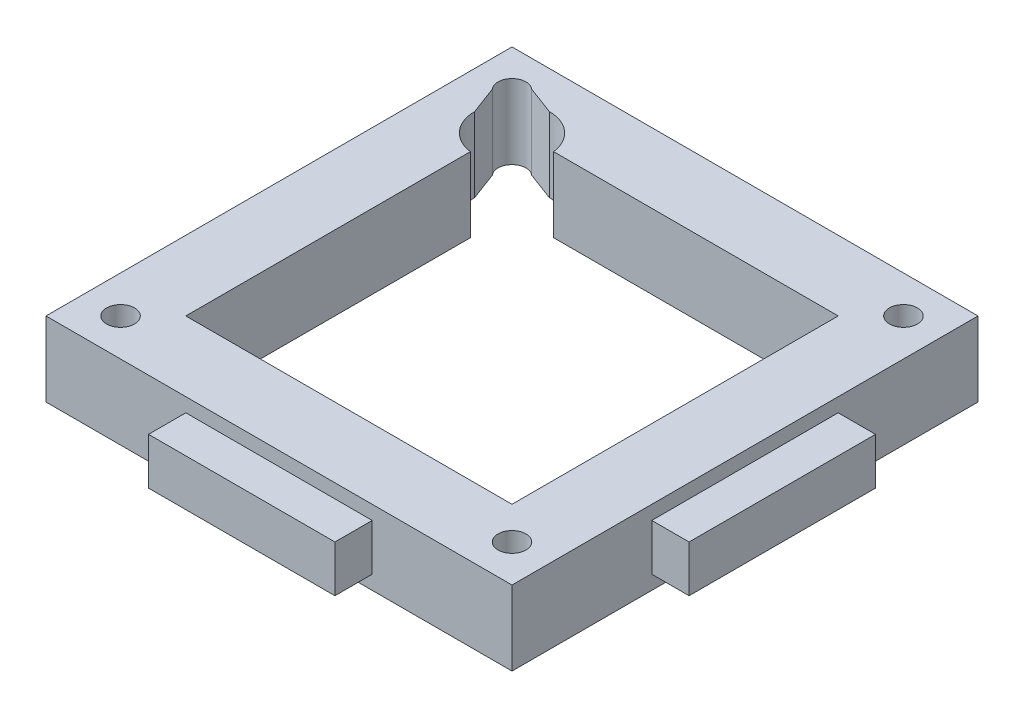
from build123d import *

# Parameters (mm, degrees)
SKETCH1_W         = 50
SKETCH1_H         = 50
SKETCH1_R         = 1.5
SUPPORT_DEPTH     = 8
NORTH_START       = -25
SKETCH2_W         = 20
SKETCH2_H         = 5
NORTH_CUT_DEPTH   = 4
SOUTH_START       = 25
SKETCH2_2_W       = 20
SKETCH2_2_H       = 5
SOUTH_DOWEL_DEPTH = 4
EAST_START        = 25
SKETCH3_W         = 20
SKETCH3_H         = 5
EAST_DOWEL_DEPTH  = 4
WEST_START        = -25
SKETCH3_3_W       = 20
SKETCH3_3_H       = 5
WEST_CUT_DEPTH    = 4


with BuildPart() as part:
    # Sketch1 → Support (new body)
    with BuildSketch(Plane(origin=(0, 0, 0), x_dir=(1, 0, 0), z_dir=(0, 1, 0))):
        Rectangle(SKETCH1_W, SKETCH1_H)
        with Locations(Location((-21, -21, 0), (0, 0, 270))):
            Circle(SKETCH1_R, mode=Mode.SUBTRACT)
        with Locations(Location((21, -21, 0), (0, 0, 270))):
            Circle(SKETCH1_R, mode=Mode.SUBTRACT)
        with BuildLine():
            Line((-13.031373033, 17.5), (17.5, 17.5))
            Line((17.5, 17.5), (17.5, -17.5))
            Line((17.5, -17.5), (-17.5, -17.5))
            Line((-17.5, -17.5), (-17.5, 13.031373033))
            ThreePointArc((-17.5, 13.031373033), (-20, 14.354248689), (-21, 17))
            Line((-21, 17), (-22.130136986, 20.01369863))
            ThreePointArc((-22.130136986, 20.01369863), (-22.060660172, 22.060660172), (-20.01369863, 22.130136986))
            Line((-20.01369863, 22.130136986), (-17, 21))
            ThreePointArc((-17, 21), (-14.354248689, 20), (-13.031373033, 17.5))
        make_face(mode=Mode.SUBTRACT)
        with Locations(Location((21, 21, 0), (0, 0, 270))):
            Circle(SKETCH1_R, mode=Mode.SUBTRACT)
    extrude(amount=SUPPORT_DEPTH)

    # Sketch2 → North Cut (cut)
    with BuildSketch(Plane.XY.offset(NORTH_START)):
        with Locations((0, 4)):
            Rectangle(SKETCH2_W, SKETCH2_H)
    extrude(amount=NORTH_CUT_DEPTH, mode=Mode.SUBTRACT)

    # Sketch2<2> → South Dowel (add)
    with BuildSketch(Plane.XY.offset(SOUTH_START)):
        with Locations((0, 4)):
            Rectangle(SKETCH2_2_W, SKETCH2_2_H)
    extrude(amount=SOUTH_DOWEL_DEPTH)

    # Sketch3 → East Dowel (add)
    with BuildSketch(Plane(origin=(0, 0, 0), x_dir=(0, 0, -1), z_dir=(1, 0, 0)).offset(EAST_START)):
        with Locations((0, 4)):
            Rectangle(SKETCH3_W, SKETCH3_H)
    extrude(amount=EAST_DOWEL_DEPTH)

    # Sketch3<3> → West Cut (cut)
    with BuildSketch(Plane(origin=(0, 0, 0), x_dir=(0, 0, -1), z_dir=(1, 0, 0)).offset(WEST_START)):
        with Locations((0, 4)):
            Rectangle(SKETCH3_3_W, SKETCH3_3_H)
    extrude(amount=WEST_CUT_DEPTH, mode=Mode.SUBTRACT)


solid = part.part
